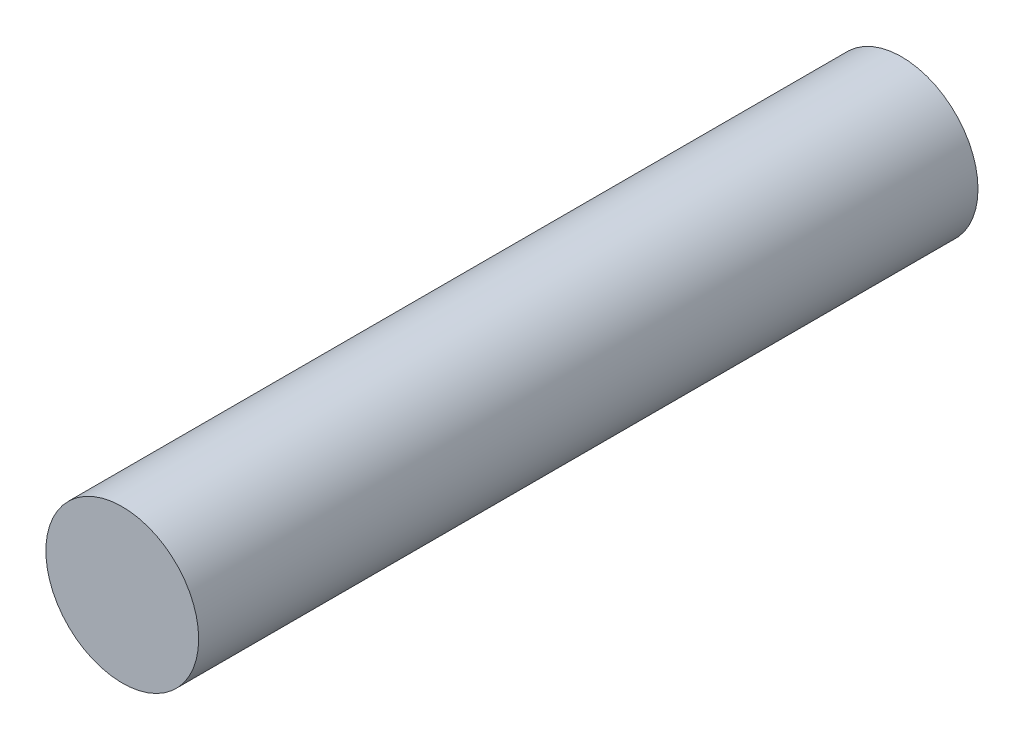
from build123d import *

# Parameters (mm, degrees)
SKETCH1_R           = 75
BOSS_EXTRUDE1_DEPTH = 765


with BuildPart() as part:
    # Sketch1 → Boss-Extrude1 (new body)
    with BuildSketch(Plane.XY):
        Circle(SKETCH1_R)
    extrude(amount=-BOSS_EXTRUDE1_DEPTH)


solid = part.part
